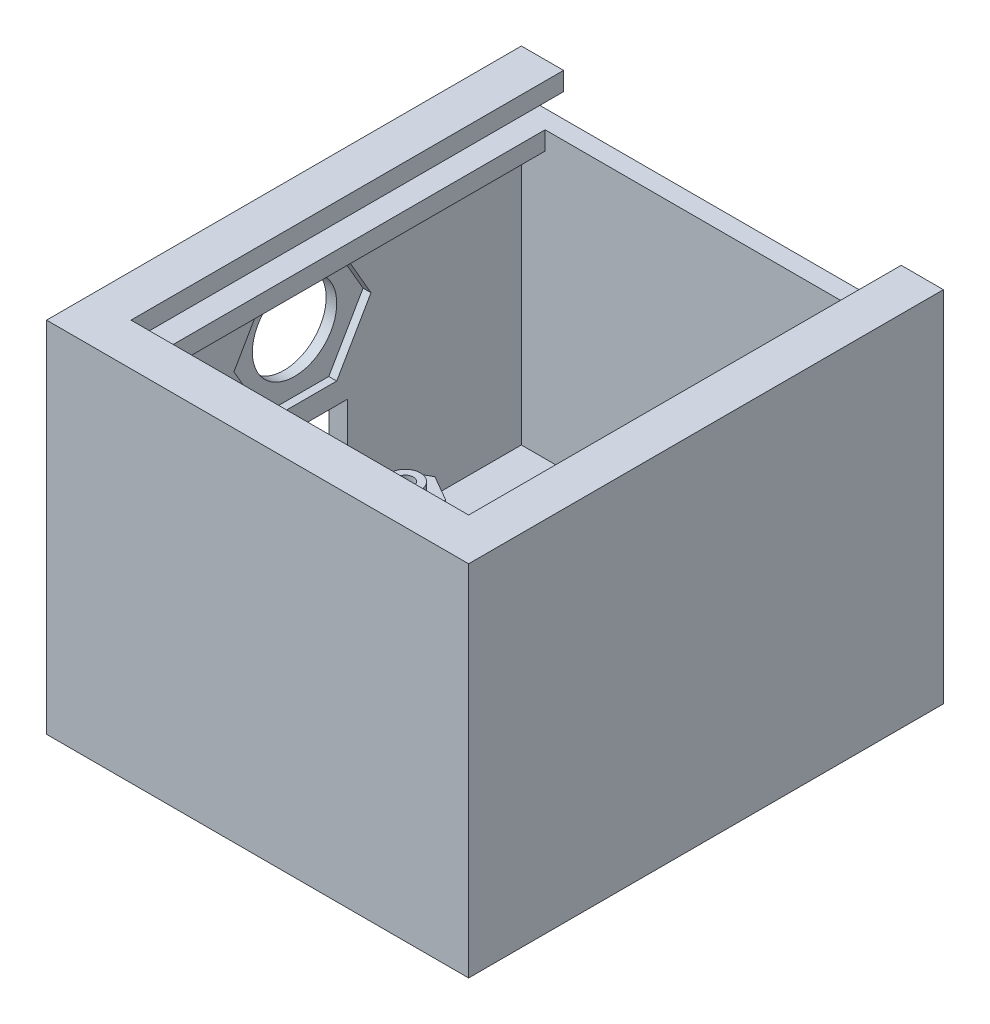
from build123d import *

# Parameters (mm, degrees)
SKETCH1_W               = 80
SKETCH1_H               = 90
BOSS_EXTRUDE1_DEPTH     = 6
SKETCH4_W               = 80
SKETCH4_H               = 90
SKETCH4_W_2             = 73
SKETCH4_H_2             = 83
BOSS_EXTRUDE2_DEPTH     = 54
SKETCH6_R               = 4.05
SKETCH6_R_2             = 5
CUT_EXTRUDE1_DEPTH      = 40
SKETCH7_R               = 7
CUT_EXTRUDE2_DEPTH      = 2.8
BOSS_EXTRUDE3_DEPTH     = 7
SKETCH11_R              = 2.85
BOSS_EXTRUDE4_DEPTH     = 2
CUT_EXTRUDE3_DEPTH      = 9
CUT_EXTRUDE3_DEPTH_BACK = 6
SKETCH5_R               = 1.5
CUT_EXTRUDE4_DEPTH      = 6
CUT_EXTRUDE4_DEPTH_BACK = 81.876448982
SKETCH12_W              = 17
SKETCH12_H              = 13.5
CUT_EXTRUDE6_DEPTH      = 3.5
SKETCH17_R              = 8
CUT_EXTRUDE8_DEPTH      = 2
CUT_EXTRUDE9_DEPTH      = 1.5
CUT_EXTRUDE10_DEPTH     = 10
BOSS_EXTRUDE5_DEPTH     = 90
BOSS_EXTRUDE5_2_DEPTH   = 90
SKETCH21_W              = 3.5
SKETCH21_H              = 8
BOSS_EXTRUDE6_DEPTH     = 80
SKETCH22_W              = 80
SKETCH22_H              = 3.5
BOSS_EXTRUDE7_DEPTH     = 4.5
SKETCH24_W              = 8
SKETCH24_H              = 3.5
BOSS_EXTRUDE8_DEPTH     = 90
SKETCH26_R              = 2
CUT_EXTRUDE11_DEPTH     = 3.5


with BuildPart() as part:
    # Sketch1 → Boss-Extrude1 (new body)
    with BuildSketch(Plane(origin=(0, 0, 0), x_dir=(1, 0, 0), z_dir=(0, 1, 0))):
        Rectangle(SKETCH1_W, SKETCH1_H)
    extrude(amount=BOSS_EXTRUDE1_DEPTH)

    # Sketch4 → Boss-Extrude2 (add)
    with BuildSketch(Plane(origin=(0, 6, 0), x_dir=(1, 0, 0), z_dir=(0, 1, 0))):
        Rectangle(SKETCH4_W, SKETCH4_H)
        Rectangle(SKETCH4_W_2, SKETCH4_H_2, mode=Mode.SUBTRACT)
    extrude(amount=BOSS_EXTRUDE2_DEPTH)

    # Sketch6 → Cut-Extrude1 (cut)
    with BuildSketch(Plane(origin=(0, 6, 0), x_dir=(1, 0, 0), z_dir=(0, 1, 0))):
        with Locations(Location((-20, 25, 0), (0, 0, 270))):
            Circle(SKETCH6_R)
        with Locations(Location((-20, -25, 0), (0, 0, 270))):
            Circle(SKETCH6_R)
        with Locations(Location((20, -25, 0), (0, 0, 270))):
            Circle(SKETCH6_R_2)
    extrude(amount=-CUT_EXTRUDE1_DEPTH, mode=Mode.SUBTRACT)

    # Sketch7 → Cut-Extrude2 (cut)
    with BuildSketch(Plane(origin=(0, 6, 0), x_dir=(1, 0, 0), z_dir=(0, 1, 0))):
        with Locations(Location((-20, 25, 0), (0, 0, 270))):
            Circle(SKETCH7_R)
        with Locations(Location((-20, -25, 0), (0, 0, 270))):
            Circle(SKETCH7_R)
    extrude(amount=-CUT_EXTRUDE2_DEPTH, mode=Mode.SUBTRACT)

    # Sketch10 → Boss-Extrude3 (add)
    with BuildSketch(Plane(origin=(0, 6, 0), x_dir=(1, 0, 0), z_dir=(0, 1, 0))):
        Polygon((-32.5, 21.100297611), (-37.35, 18.300148806), (-37.35, 12.699851194), (-32.5, 9.899702389), (-27.65, 12.699851194), (-27.65, 18.300148806), align=None)
        Polygon((-27.65, -12.699851194), (-32.5, -9.899702389), (-37.35, -12.699851194), (-37.35, -18.300148806), (-32.5, -21.100297611), (-27.65, -18.300148806), align=None)
    extrude(amount=BOSS_EXTRUDE3_DEPTH)

    # Sketch11 → Boss-Extrude4 (add)
    with BuildSketch(Plane(origin=(0, 13, 0), x_dir=(1, 0, 0), z_dir=(0, 1, 0))):
        with Locations(Location((-32.5, 15.5, 0), (0, 0, 270))):
            Circle(SKETCH11_R)
        with Locations(Location((-32.5, -15.5, 0), (0, 0, 270))):
            Circle(SKETCH11_R)
    extrude(amount=BOSS_EXTRUDE4_DEPTH)

    # Sketch5 → Cut-Extrude3 (cut, two sides: drawn at the far end of the back side and taken through both)
    with BuildSketch(Plane(origin=(0, 6, 0), x_dir=(1, 0, 0), z_dir=(0, 1, 0)).offset(-CUT_EXTRUDE3_DEPTH_BACK)):
        with Locations(Location((-32.5, 15.5, 0), (0, 0, 270))):
            Circle(SKETCH5_R)
        with Locations(Location((-32.5, -15.5, 0), (0, 0, 270))):
            Circle(SKETCH5_R)
    extrude(amount=CUT_EXTRUDE3_DEPTH + CUT_EXTRUDE3_DEPTH_BACK, mode=Mode.SUBTRACT)

    # Sketch8 → Cut-Extrude4 (cut, two sides: drawn at the far end of the back side and taken through both)
    with BuildSketch(Plane(origin=(0, 6, 0), x_dir=(1, 0, 0), z_dir=(0, 1, 0)).offset(-CUT_EXTRUDE4_DEPTH_BACK)):
        Polygon((-29.65, 17.145448267), (-32.5, 18.790896534), (-35.35, 17.145448267), (-35.35, 13.854551733), (-32.5, 12.209103466), (-29.65, 13.854551733), align=None)
        Polygon((-29.65, -13.854551733), (-32.5, -12.209103466), (-35.35, -13.854551733), (-35.35, -17.145448267), (-32.5, -18.790896534), (-29.65, -17.145448267), align=None)
    extrude(amount=CUT_EXTRUDE4_DEPTH + CUT_EXTRUDE4_DEPTH_BACK, mode=Mode.SUBTRACT)

    # Sketch12 → Cut-Extrude6 (cut)
    with BuildSketch(Plane(origin=(-36.5, 0, 0), x_dir=(0, 0, -1), z_dir=(1, 0, 0))):
        with Locations((0, 23.25)):
            Rectangle(SKETCH12_W, SKETCH12_H)
    extrude(amount=-CUT_EXTRUDE6_DEPTH, mode=Mode.SUBTRACT)

    # Sketch17 → Cut-Extrude8 (cut)
    with BuildSketch(Plane.ZY.offset(40)):
        with Locations((0, 45.25)):
            Circle(SKETCH17_R)
    extrude(amount=-CUT_EXTRUDE8_DEPTH, mode=Mode.SUBTRACT)

    # Sketch15 → Cut-Extrude9 (cut)
    with BuildSketch(Plane(origin=(-36.5, 0, 0), x_dir=(0, 0, -1), z_dir=(1, 0, 0))):
        Polygon((-6.495190528, 56.5), (-12.990381057, 45.25), (-6.495190528, 34), (6.495190528, 34), (12.990381057, 45.25), (6.495190528, 56.5), align=None)
    extrude(amount=-CUT_EXTRUDE9_DEPTH, mode=Mode.SUBTRACT)

    # Sketch19 → Cut-Extrude10 (cut)
    with BuildSketch(Plane(origin=(0, 6, 0), x_dir=(1, 0, 0), z_dir=(0, 1, 0))):
        with BuildLine():
            Line((-3.5, -5.5), (-3.5, 5.5))
            ThreePointArc((-3.5, 5.5), (0, 9), (3.5, 5.5))
            Line((3.5, 5.5), (3.5, -5.5))
            ThreePointArc((3.5, -5.5), (0, -9), (-3.5, -5.5))
        make_face()
    extrude(amount=-CUT_EXTRUDE10_DEPTH, mode=Mode.SUBTRACT)



with BuildPart() as body_2:
    # Sketch20 → Boss-Extrude5 (new body)
    with BuildSketch(Plane(origin=(0, 0, -45), x_dir=(-1, 0, 0), z_dir=(0, 0, -1))):
        Polygon((-40, 60), (-36.5, 60), (-36.5, 64.5), (-32, 64.5), (-32, 68), (-40, 68), align=None)
    extrude(amount=-BOSS_EXTRUDE5_DEPTH)


with BuildPart() as body_3:
    # Sketch20 → Boss-Extrude5 2 (new body)
    with BuildSketch(Plane(origin=(0, 0, -45), x_dir=(-1, 0, 0), z_dir=(0, 0, -1))):
        Polygon((40, 60), (36.5, 60), (36.5, 64.5), (32, 64.5), (32, 68), (40, 68), align=None)
    extrude(amount=-BOSS_EXTRUDE5_2_DEPTH)


with BuildPart() as part_1:
    add(part.part)

    add(body_2.part)  # Boss-Extrude6 merges body 2
    # Sketch21 → Boss-Extrude6 (add)
    with BuildSketch(Plane(origin=(40, 0, 0), x_dir=(0, 0, -1), z_dir=(1, 0, 0))):
        with Locations((-43.25, 64)):
            Rectangle(SKETCH21_W, SKETCH21_H)
    extrude(amount=-BOSS_EXTRUDE6_DEPTH)


    add(body_3.part)  # Boss-Extrude7 merges body 3
    # Sketch22 → Boss-Extrude7 (add)
    with BuildSketch(Plane(origin=(0, 0, 41.5), x_dir=(-1, 0, 0), z_dir=(0, 0, -1))):
        with Locations((0, 66.25)):
            Rectangle(SKETCH22_W, SKETCH22_H)
    extrude(amount=BOSS_EXTRUDE7_DEPTH)

    # Sketch24 → Boss-Extrude8 (add)
    with BuildSketch(Plane.XY.offset(45)):
        with Locations((-36, 58.25)):
            Rectangle(SKETCH24_W, SKETCH24_H)
        with Locations((36, 58.25)):
            Rectangle(SKETCH24_W, SKETCH24_H)
    extrude(amount=-BOSS_EXTRUDE8_DEPTH)

    # Sketch26 → Cut-Extrude11 (cut)
    with BuildSketch(Plane.ZY.offset(40)):
        with Locations((16.5, 40)):
            Circle(SKETCH26_R)
        with Locations((33.5, 40)):
            Circle(SKETCH26_R)
        with BuildLine():
            Line((21.5, 42), (28.5, 42))
            ThreePointArc((28.5, 42), (30.5, 40), (28.5, 38))
            Line((28.5, 38), (21.5, 38))
            ThreePointArc((21.5, 38), (19.5, 40), (21.5, 42))
        make_face()
    extrude(amount=-CUT_EXTRUDE11_DEPTH, mode=Mode.SUBTRACT)


solid = part_1.part
